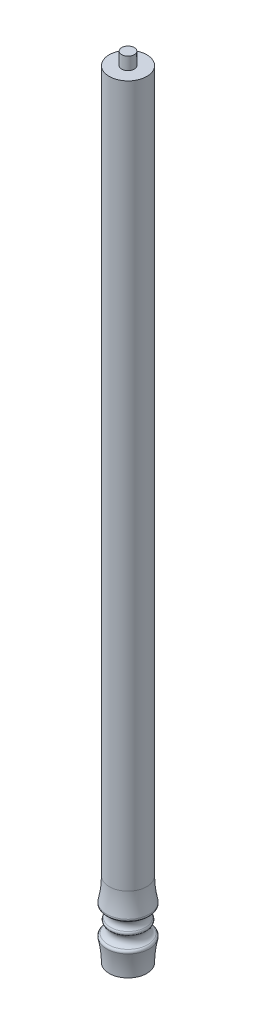
from build123d import *


with BuildPart() as part:
    # revolve sketch → Revolve1 (revolve)
    with BuildSketch(Plane.XY, mode=Mode.PRIVATE) as revolve1_sk:
        with BuildLine():
            Line((0, 0), (19.05, 0))
            ThreePointArc((19.05, 0), (19.692539758, 11.497446902), (21.612156952, 22.851706562))
            ThreePointArc((21.612156952, 22.851706562), (21.368821871, 24.623609523), (20.018018165, 25.795864363))
            ThreePointArc((20.018018165, 25.795864363), (17.012666806, 28.123144244), (15.875, 31.75))
            ThreePointArc((15.875, 31.75), (16.370840305, 34.209941923), (17.780925752, 36.285714286))
            ThreePointArc((17.780925752, 36.285714286), (18.543296053, 38.1), (17.780925752, 39.914285714))
            ThreePointArc((17.780925752, 39.914285714), (16.370840305, 41.990058077), (15.875, 44.45))
            ThreePointArc((15.875, 44.45), (17.012666806, 48.076855756), (20.018018165, 50.404135637))
            ThreePointArc((20.018018165, 50.404135637), (21.368821871, 51.576390477), (21.612156952, 53.348293438))
            ThreePointArc((21.612156952, 53.348293438), (19.692539758, 64.702553098), (19.05, 76.2))
            Line((19.05, 76.2), (19.05, 787.4))
            Line((19.05, 787.4), (6.35, 787.4))
            Line((6.35, 787.4), (6.35, 800.1))
            Line((6.35, 800.1), (0, 800.1))
            Line((0, 800.1), (0, 0))
        make_face()
    revolve(revolve1_sk.sketch.rotate(Axis((0, -55, 0), (0, 1, 0)), 90), axis=Axis((0, -55, 0), (0, 1, 0)))


solid = part.part
